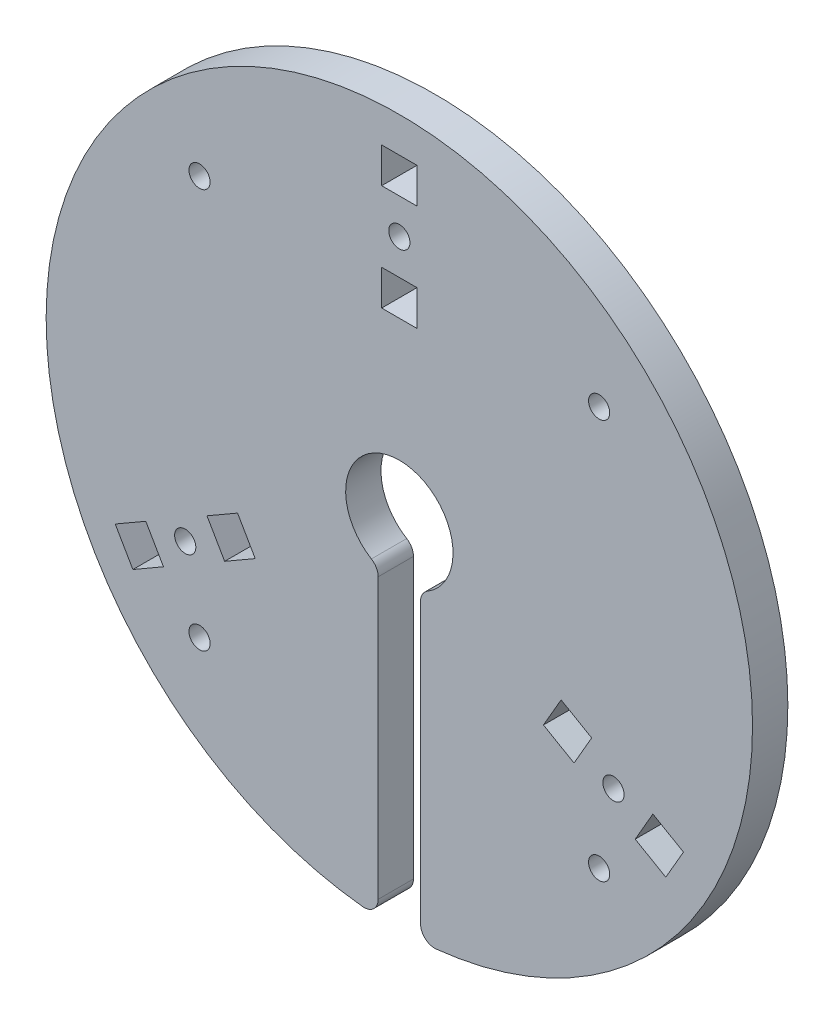
from build123d import *

# Parameters (mm, degrees)
ESQUISSE1_R        = 1.5
ESQUISSE1_W        = 5
ESQUISSE1_H        = 5
BOSS_EXTRU_1_DEPTH = 5
FILLET1_R          = 2


with BuildPart() as part:
    # Esquisse1 → Boss.-Extru.1 (new body)
    with BuildSketch(Plane.XY):
        with BuildLine():
            Line((-3, -6.9828361), (-3, -49.909918854))
            ThreePointArc((-3, -49.909918854), (0, 50), (3, -49.909918854))
            Line((3, -49.909918854), (3, -6.9828361))
            ThreePointArc((3, -6.9828361), (0, 7.6), (-3, -6.9828361))
        make_face()
        with Locations((28.284271247, 28.284271247)):
            Circle(ESQUISSE1_R, mode=Mode.SUBTRACT)
        with Locations(Location((28.284271247, -28.284271247, 0), (0, 0, 180))):
            Circle(ESQUISSE1_R, mode=Mode.SUBTRACT)
        with Locations(Location((-28.284271247, 28.284271247, 0), (0, 0, 180))):
            Circle(ESQUISSE1_R, mode=Mode.SUBTRACT)
        with Locations((-28.284271247, -28.284271247)):
            Circle(ESQUISSE1_R, mode=Mode.SUBTRACT)
        with Locations((0, 35)):
            Circle(ESQUISSE1_R, mode=Mode.SUBTRACT)
        with Locations((-30.310889132, -17.5)):
            Circle(ESQUISSE1_R, mode=Mode.SUBTRACT)
        with Locations((30.310889132, -17.5)):
            Circle(ESQUISSE1_R, mode=Mode.SUBTRACT)
        with Locations((0, 27.5)):
            Rectangle(ESQUISSE1_W, ESQUISSE1_H, mode=Mode.SUBTRACT)
        with Locations((0, 42.5)):
            Rectangle(ESQUISSE1_W, ESQUISSE1_H, mode=Mode.SUBTRACT)
        Polygon((-35.891016151, -17.834936491), (-40.22114317, -20.334936491), (-37.72114317, -24.665063509), (-33.391016151, -22.165063509), align=None, mode=Mode.SUBTRACT)
        Polygon((-27.230762114, -12.834936491), (-22.900635095, -10.334936491), (-20.400635095, -14.665063509), (-24.730762114, -17.165063509), align=None, mode=Mode.SUBTRACT)
        Polygon((27.230762114, -12.834936491), (22.900635095, -10.334936491), (20.400635095, -14.665063509), (24.730762114, -17.165063509), align=None, mode=Mode.SUBTRACT)
        Polygon((35.891016151, -17.834936491), (40.22114317, -20.334936491), (37.72114317, -24.665063509), (33.391016151, -22.165063509), align=None, mode=Mode.SUBTRACT)
    extrude(amount=BOSS_EXTRU_1_DEPTH)

    # Fillet1
    fillet1_edges = [part.edges().sort_by_distance(p)[0] for p in [
        (-3, -6.9828361, 2.5),
        (-3, -49.909918854, 2.5),
        (3, -49.909918854, 2.5),
        (3, -6.9828361, 2.5),
    ]]
    fillet(fillet1_edges, radius=FILLET1_R)


solid = part.part
